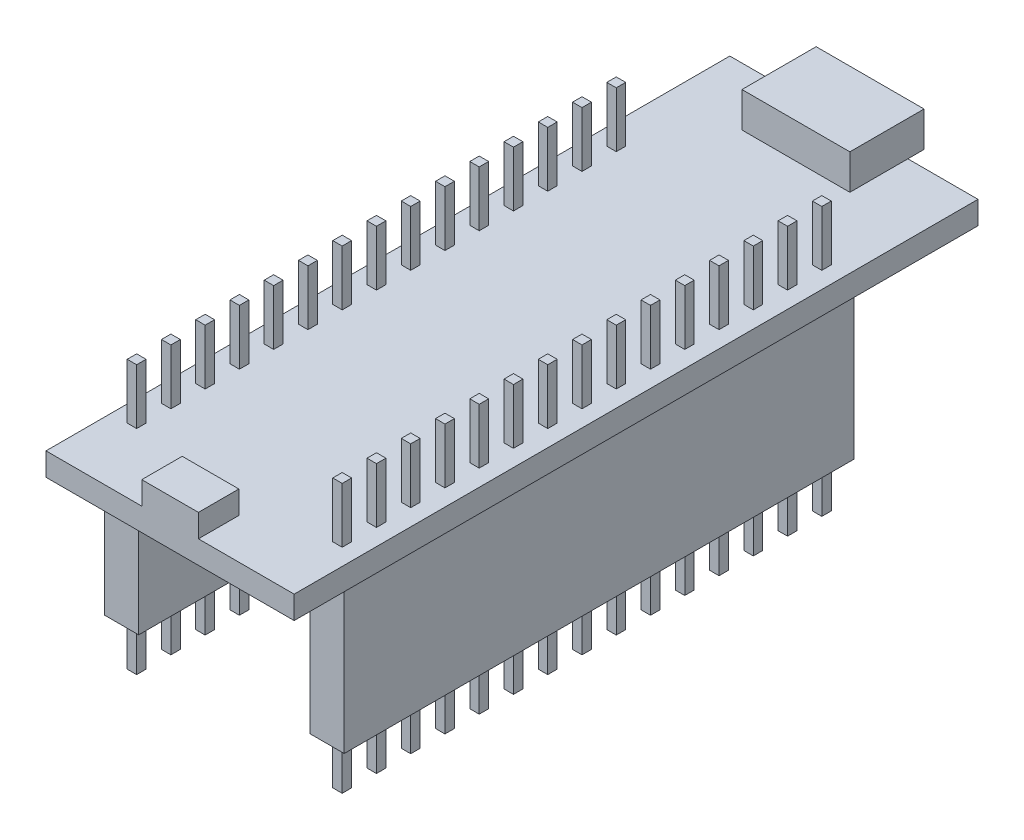
from build123d import *

# Parameters (mm, degrees)
ESQUISSE1_W             = 18.4
ESQUISSE1_H             = 50.7
BOSS_EXTRU_1_DEPTH      = 1.7
BOSS_EXTRU_2_DEPTH      = 5.8
BOSS_EXTRU_2_DEPTH_BACK = 14.1
ESQUISSE2_W             = 0.7
ESQUISSE2_H             = 0.7
ESQUISSE3_W             = 2.54
ESQUISSE3_H             = 37.8
BOSS_EXTRU_3_DEPTH      = 10.7
ESQUISSE4_W             = 8
ESQUISSE4_H             = 5.5
BOSS_EXTRU_4_DEPTH      = 2.6
ESQUISSE5_W             = 4.2
ESQUISSE5_H             = 3
BOSS_EXTRU_5_DEPTH      = 1.7


with BuildPart() as part:
    # Esquisse1 → Boss.-Extru.1 (new body)
    with BuildSketch(Plane(origin=(0, 0, 0), x_dir=(1, 0, 0), z_dir=(0, 1, 0))):
        Rectangle(ESQUISSE1_W, ESQUISSE1_H)
    extrude(amount=BOSS_EXTRU_1_DEPTH)

    # Esquisse2 → Boss.-Extru.2 (add, two sides: drawn at the far end of the back side and taken through both)
    with BuildSketch(Plane(origin=(0, 0, 0), x_dir=(1, 0, 0), z_dir=(0, 1, 0)).offset(-BOSS_EXTRU_2_DEPTH_BACK)):
        with Locations((-7.62, 15.35)):
            Rectangle(ESQUISSE2_W, ESQUISSE2_H)
        with Locations((7.62, 15.35)):
            Rectangle(ESQUISSE2_W, ESQUISSE2_H)
        with Locations((-7.62, 12.81)):
            Rectangle(ESQUISSE2_W, ESQUISSE2_H)
        with Locations((7.62, 12.81)):
            Rectangle(ESQUISSE2_W, ESQUISSE2_H)
        with Locations((-7.62, 10.27)):
            Rectangle(ESQUISSE2_W, ESQUISSE2_H)
        with Locations((7.62, 10.27)):
            Rectangle(ESQUISSE2_W, ESQUISSE2_H)
        with Locations((-7.62, 7.73)):
            Rectangle(ESQUISSE2_W, ESQUISSE2_H)
        with Locations((7.62, 7.73)):
            Rectangle(ESQUISSE2_W, ESQUISSE2_H)
        with Locations((-7.62, 5.19)):
            Rectangle(ESQUISSE2_W, ESQUISSE2_H)
        with Locations((7.62, 5.19)):
            Rectangle(ESQUISSE2_W, ESQUISSE2_H)
        with Locations((-7.62, 2.65)):
            Rectangle(ESQUISSE2_W, ESQUISSE2_H)
        with Locations((7.62, 2.65)):
            Rectangle(ESQUISSE2_W, ESQUISSE2_H)
        with Locations((-7.62, 0.11)):
            Rectangle(ESQUISSE2_W, ESQUISSE2_H)
        with Locations((7.62, 0.11)):
            Rectangle(ESQUISSE2_W, ESQUISSE2_H)
        with Locations((-7.62, -2.43)):
            Rectangle(ESQUISSE2_W, ESQUISSE2_H)
        with Locations((7.62, -2.43)):
            Rectangle(ESQUISSE2_W, ESQUISSE2_H)
        with Locations((-7.62, -4.97)):
            Rectangle(ESQUISSE2_W, ESQUISSE2_H)
        with Locations((7.62, -4.97)):
            Rectangle(ESQUISSE2_W, ESQUISSE2_H)
        with Locations((-7.62, -7.51)):
            Rectangle(ESQUISSE2_W, ESQUISSE2_H)
        with Locations((7.62, -7.51)):
            Rectangle(ESQUISSE2_W, ESQUISSE2_H)
        with Locations((-7.62, -10.05)):
            Rectangle(ESQUISSE2_W, ESQUISSE2_H)
        with Locations((7.62, -10.05)):
            Rectangle(ESQUISSE2_W, ESQUISSE2_H)
        with Locations((-7.62, -12.59)):
            Rectangle(ESQUISSE2_W, ESQUISSE2_H)
        with Locations((7.62, -12.59)):
            Rectangle(ESQUISSE2_W, ESQUISSE2_H)
        with Locations((-7.62, -15.13)):
            Rectangle(ESQUISSE2_W, ESQUISSE2_H)
        with Locations((7.62, -15.13)):
            Rectangle(ESQUISSE2_W, ESQUISSE2_H)
        with Locations((-7.62, -17.67)):
            Rectangle(ESQUISSE2_W, ESQUISSE2_H)
        with Locations((7.62, -17.67)):
            Rectangle(ESQUISSE2_W, ESQUISSE2_H)
        with Locations((-7.62, -20.21)):
            Rectangle(ESQUISSE2_W, ESQUISSE2_H)
        with Locations((7.62, -20.21)):
            Rectangle(ESQUISSE2_W, ESQUISSE2_H)
    extrude(amount=BOSS_EXTRU_2_DEPTH + BOSS_EXTRU_2_DEPTH_BACK)

    # Esquisse3 → Boss.-Extru.3 (add)
    with BuildSketch(Plane(origin=(0, 0, 0), x_dir=(1, 0, 0), z_dir=(0, 1, 0))):
        with Locations((-7.62, -2.43)):
            Rectangle(ESQUISSE3_W, ESQUISSE3_H)
        with Locations((7.62, -2.43)):
            Rectangle(ESQUISSE3_W, ESQUISSE3_H)
    extrude(amount=-BOSS_EXTRU_3_DEPTH)

    # Esquisse4 → Boss.-Extru.4 (add)
    with BuildSketch(Plane(origin=(0, 1.7, 0), x_dir=(1, 0, 0), z_dir=(0, 1, 0))):
        with Locations((0, 23.8)):
            Rectangle(ESQUISSE4_W, ESQUISSE4_H)
    extrude(amount=BOSS_EXTRU_4_DEPTH)

    # Esquisse5 → Boss.-Extru.5 (add)
    with BuildSketch(Plane(origin=(0, 1.7, 0), x_dir=(1, 0, 0), z_dir=(0, 1, 0))):
        with Locations((0, -23.85)):
            Rectangle(ESQUISSE5_W, ESQUISSE5_H)
    extrude(amount=BOSS_EXTRU_5_DEPTH)


solid = part.part
